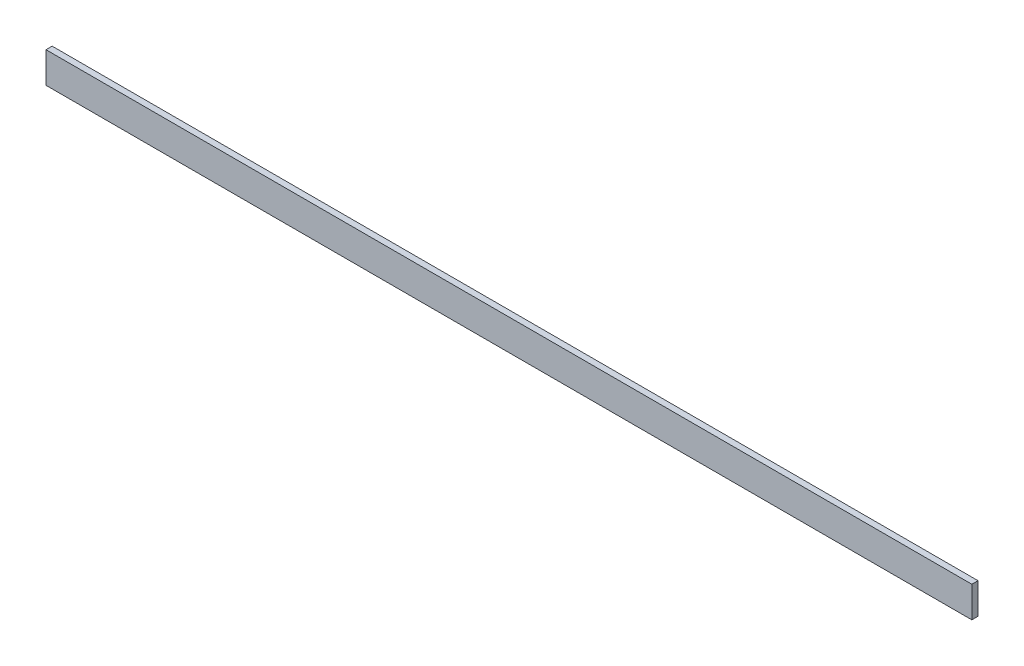
from build123d import *

# Parameters (mm, degrees)
SKETCH1_W           = 300
SKETCH1_H           = 10
BOSS_EXTRUDE1_DEPTH = 2


with BuildPart() as part:
    # Sketch1 → Boss-Extrude1 (new body)
    with BuildSketch(Plane.XY):
        Rectangle(SKETCH1_W, SKETCH1_H)
    extrude(amount=BOSS_EXTRUDE1_DEPTH)


solid = part.part
